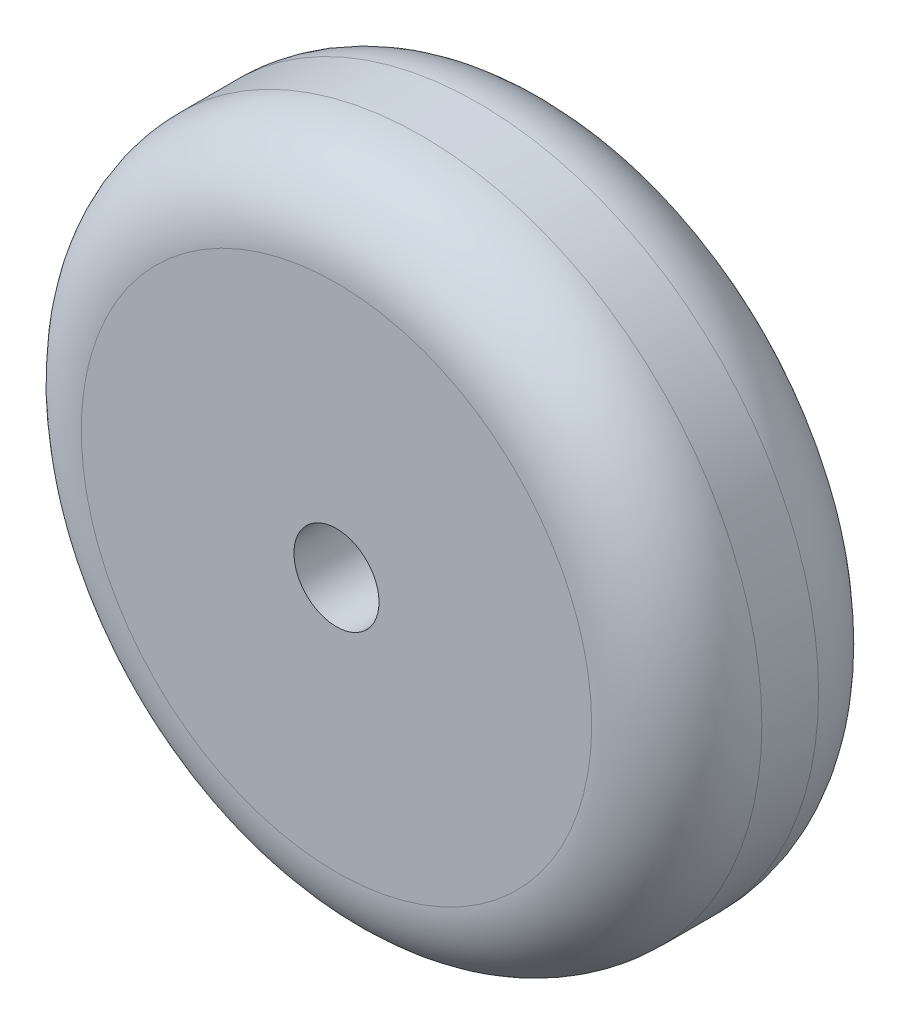
from build123d import *

# Parameters (mm, degrees)
SKETCH1_R           = 6
BOSS_EXTRUDE1_DEPTH = 2
SKETCH2_R           = 0.75
CUT_EXTRUDE1_DEPTH  = 2
FILLET1_R           = 1.5


with BuildPart() as part:
    # Sketch1 → Boss-Extrude1 (new, symmetric)
    with BuildSketch(Plane.XY):
        Circle(SKETCH1_R)
    extrude(amount=BOSS_EXTRUDE1_DEPTH, both=True)

    # Sketch2 → Cut-Extrude1 (cut, symmetric)
    with BuildSketch(Plane.XY):
        Circle(SKETCH2_R)
    extrude(amount=CUT_EXTRUDE1_DEPTH, both=True, mode=Mode.SUBTRACT)

    # Fillet1
    fillet1_edges = [part.edges().sort_by_distance(p)[0] for p in [
        (-6, 0, -2),
        (-6, 0, 2),
    ]]
    fillet(fillet1_edges, radius=FILLET1_R)


solid = part.part
